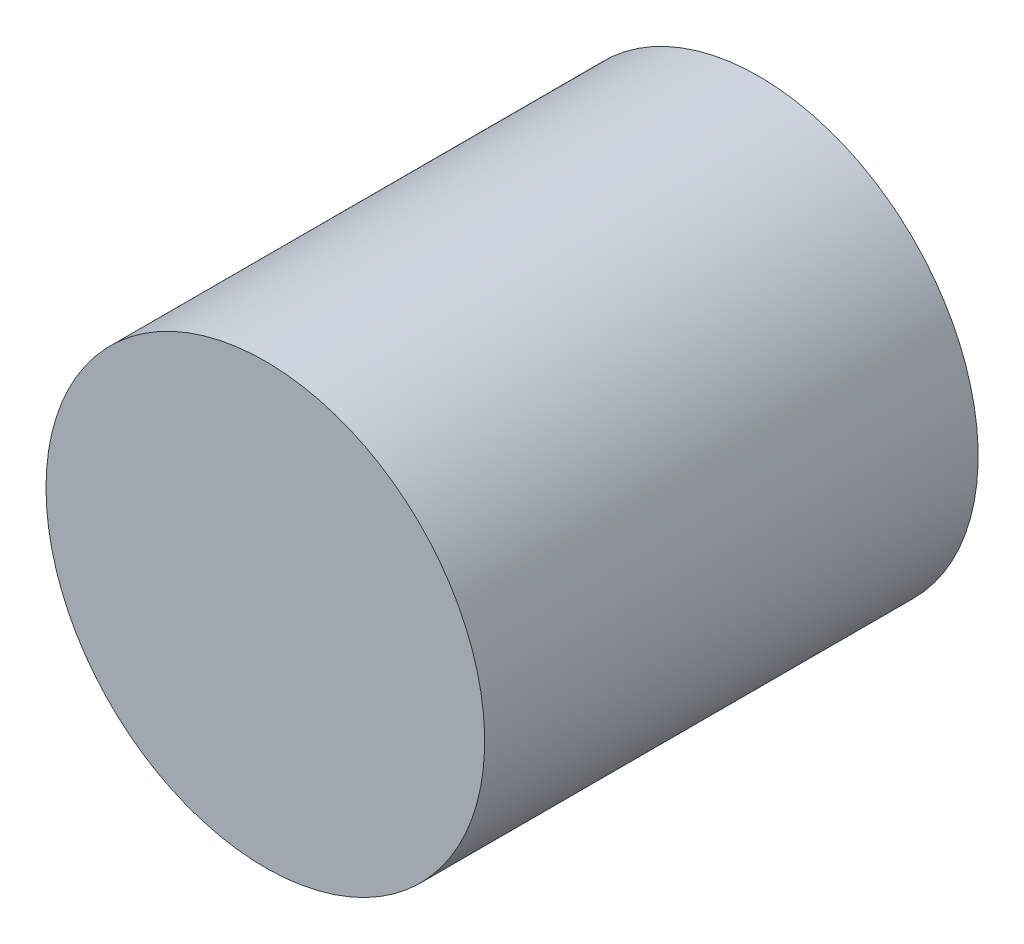
from build123d import *

# Parameters (mm, degrees)
SKETCH1_R           = 20
BOSS_EXTRUDE1_DEPTH = 45


with BuildPart() as part:
    # Sketch1 → Boss-Extrude1 (new body)
    with BuildSketch(Plane.XY):
        with Locations(Location((0, 0, 0), (0, 0, 180))):
            Circle(SKETCH1_R)
    extrude(amount=BOSS_EXTRUDE1_DEPTH)


solid = part.part
